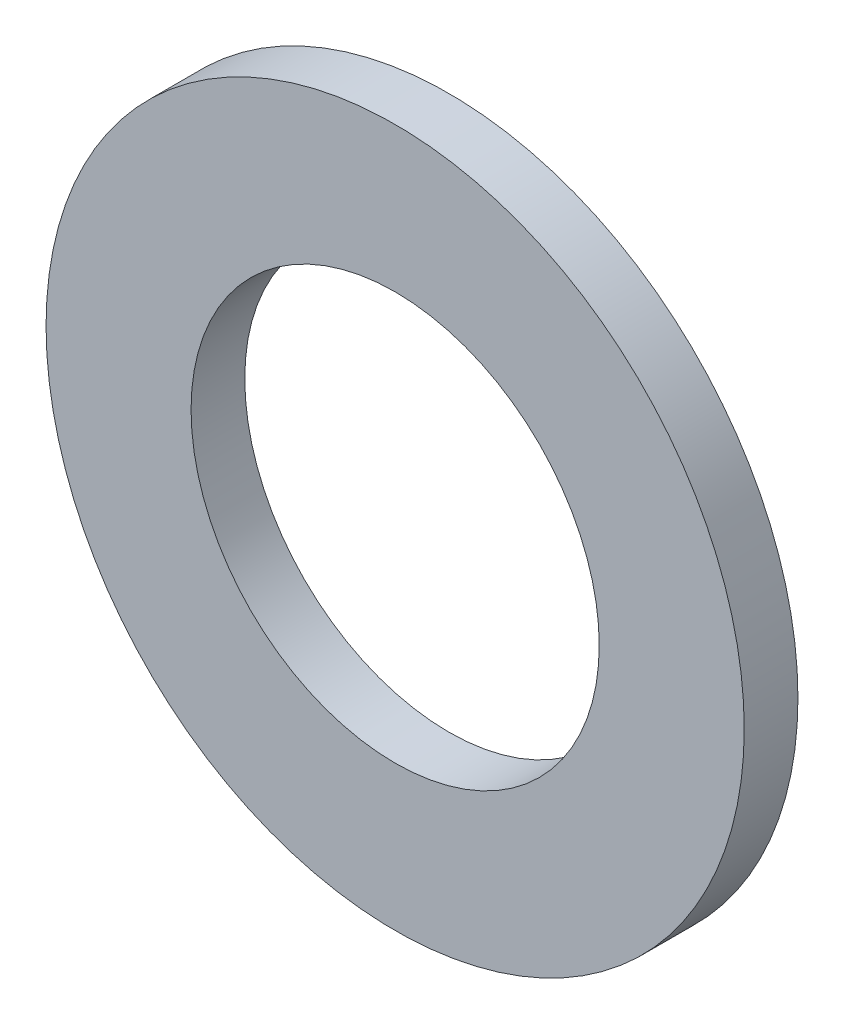
from build123d import *

# Parameters (mm, degrees)
SKETCH_1_R      = 32.5
SKETCH_1_R_2    = 19
EXTRUDE_1_DEPTH = 5


with BuildPart() as part:
    # Эскиз1 → Вытянуть1 (new body)
    with BuildSketch(Plane.XY):
        Circle(SKETCH_1_R)
        Circle(SKETCH_1_R_2, mode=Mode.SUBTRACT)
    extrude(amount=EXTRUDE_1_DEPTH)


solid = part.part
